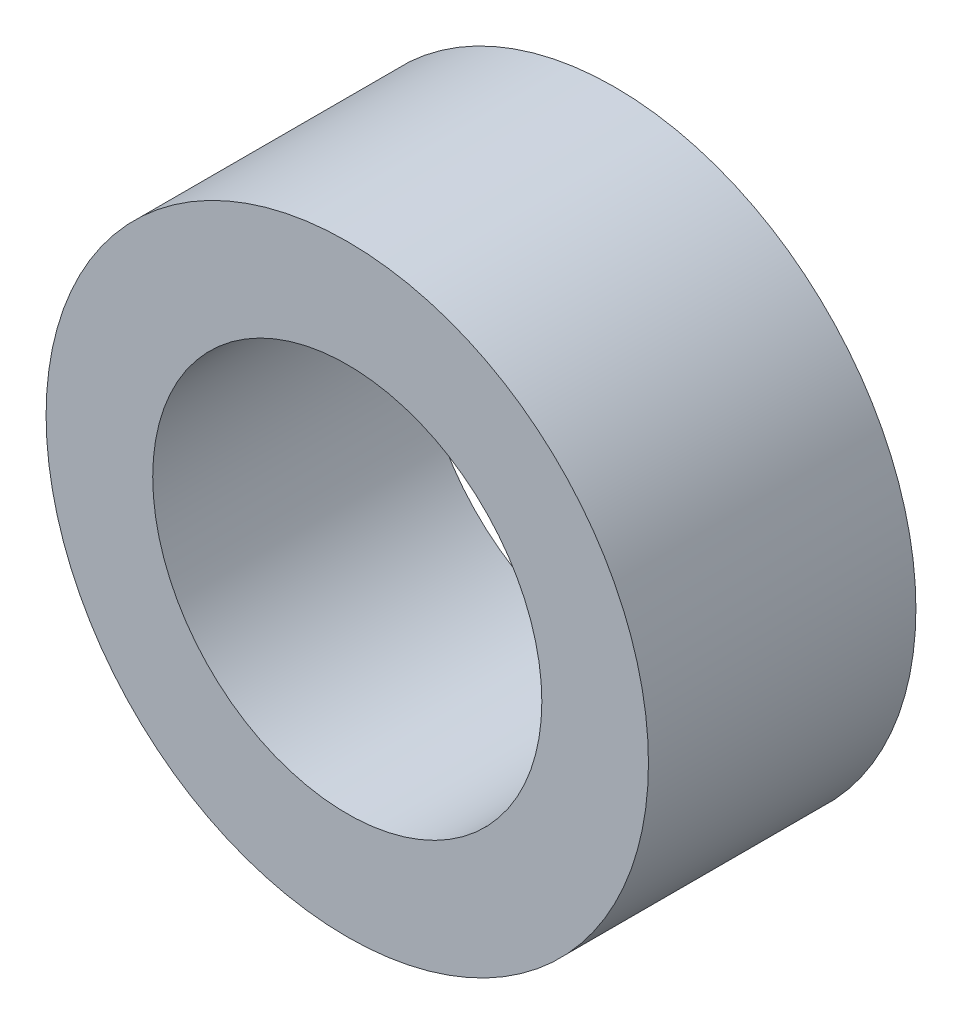
from build123d import *

# Parameters (mm, degrees)
SKETCH1_R           = 6.35
SKETCH1_R_2         = 4.1021
BOSS_EXTRUDE1_DEPTH = 5.6388


with BuildPart() as part:
    # Sketch1 → Boss-Extrude1 (new body)
    with BuildSketch(Plane.XY):
        Circle(SKETCH1_R)
        Circle(SKETCH1_R_2, mode=Mode.SUBTRACT)
    extrude(amount=BOSS_EXTRUDE1_DEPTH)


solid = part.part
